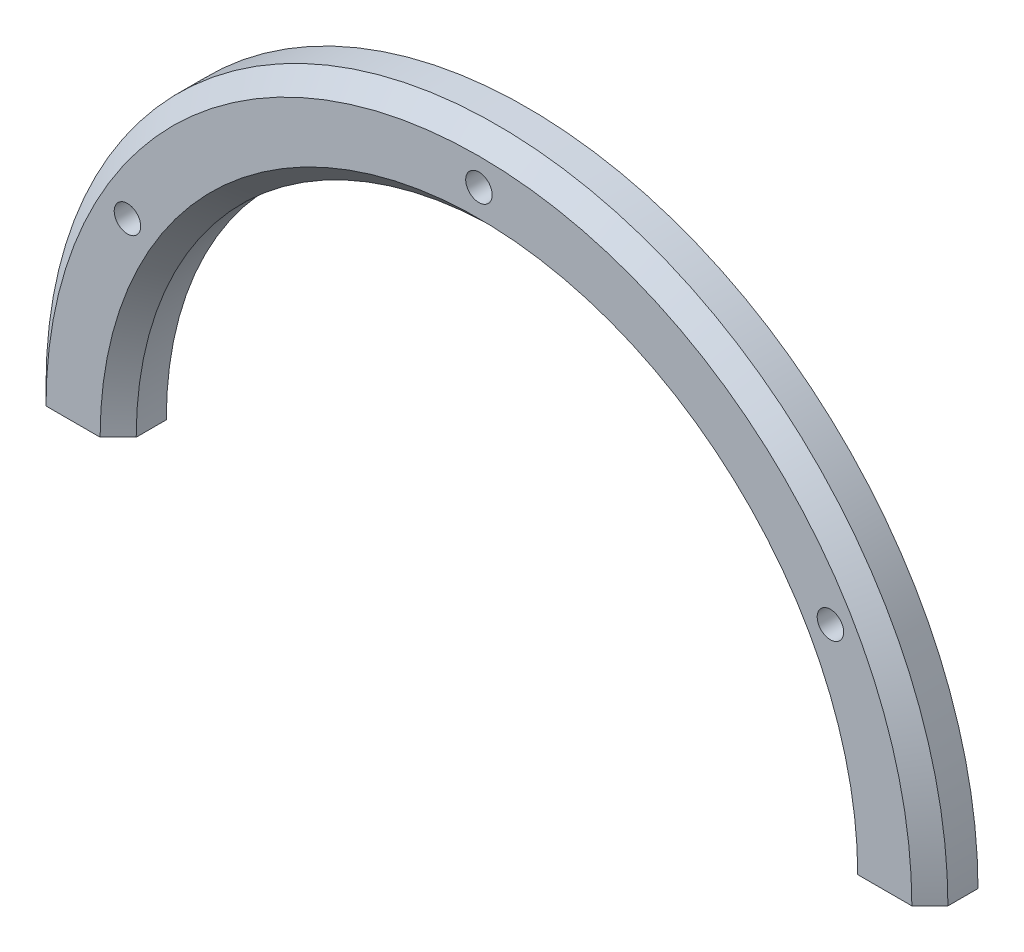
from build123d import *

# Parameters (mm, degrees)
CROQUIS1_R              = 2.2
SALIENTE_EXTRUIR1_DEPTH = 8
CHAFL_N1_SIZE           = 3


with BuildPart() as part:
    # Croquis1 → Saliente-Extruir1 (new body)
    with BuildSketch(Plane.XY):
        with BuildLine():
            Line((-75, 0), (-60, 0))
            ThreePointArc((-60, 0), (0, 60), (60, 0))
            Line((60, 0), (75, 0))
            ThreePointArc((75, 0), (0, 75), (-75, 0))
        make_face()
        with Locations((0, 67.5)):
            Circle(CROQUIS1_R, mode=Mode.SUBTRACT)
        with Locations((-58.456714755, 33.75)):
            Circle(CROQUIS1_R, mode=Mode.SUBTRACT)
        with Locations((58.456714755, 33.75)):
            Circle(CROQUIS1_R, mode=Mode.SUBTRACT)
    extrude(amount=SALIENTE_EXTRUIR1_DEPTH)

    # Chaflán1
    chafl_n1_edges = [part.edges().sort_by_distance(p)[0] for p in [
        (0, 75, 8),
        (0, 60, 8),
    ]]
    chamfer(chafl_n1_edges, length=CHAFL_N1_SIZE)


solid = part.part
